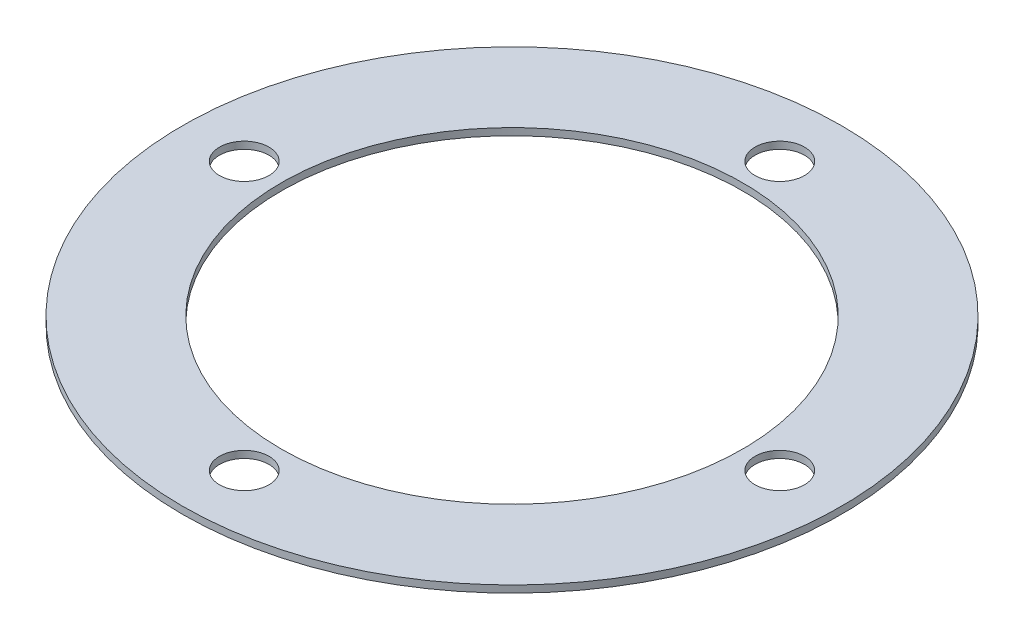
from build123d import *

# Parameters (mm, degrees)
SKETCH1_R           = 40
SKETCH1_R_2         = 28
SKETCH1_R_3         = 3
BOSS_EXTRUDE1_DEPTH = 0.86


with BuildPart() as part:
    # Sketch1 → Boss-Extrude1 (new body)
    with BuildSketch(Plane(origin=(0, 0, 0), x_dir=(1, 0, 0), z_dir=(0, 1, 0))):
        with Locations(Location((0, 0, 0), (0, 0, 270))):
            Circle(SKETCH1_R)
        with Locations(Location((0, 0, 0), (0, 0, 270))):
            Circle(SKETCH1_R_2, mode=Mode.SUBTRACT)
        with Locations(Location((0, 32.5, 0), (0, 0, 270))):
            Circle(SKETCH1_R_3, mode=Mode.SUBTRACT)
        with Locations(Location((-32.5, 0, 0), (0, 0, 270))):
            Circle(SKETCH1_R_3, mode=Mode.SUBTRACT)
        with Locations(Location((0, -32.5, 0), (0, 0, 270))):
            Circle(SKETCH1_R_3, mode=Mode.SUBTRACT)
        with Locations(Location((32.5, 0, 0), (0, 0, 270))):
            Circle(SKETCH1_R_3, mode=Mode.SUBTRACT)
    extrude(amount=BOSS_EXTRUDE1_DEPTH)


solid = part.part
